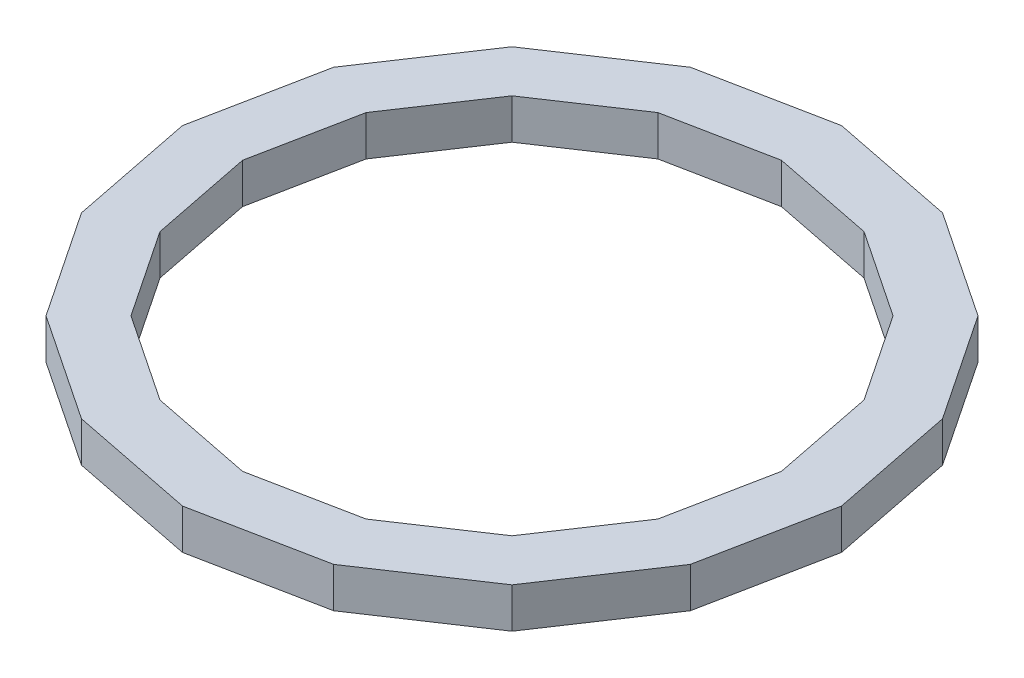
from build123d import *

# Parameters (mm, degrees)
BOSS_EXTRUDE1_DEPTH = 19.05


with BuildPart() as part:
    # Sketch1 → Boss-Extrude1 (new body)
    with BuildSketch(Plane(origin=(0, 0, 0), x_dir=(1, 0, 0), z_dir=(0, 1, 0))):
        Polygon((156.235325694, 0), (144.342619664, 59.788670693), (110.475058259, 110.475058259), (59.788670693, 144.342619664), (0, 156.235325694), (-59.788670693, 144.342619664), (-110.475058259, 110.475058259), (-144.342619664, 59.788670693), (-156.235325694, 0), (-144.342619664, -59.788670693), (-110.475058259, -110.475058259), (-59.788670693, -144.342619664), (0, -156.235325694), (59.788670693, -144.342619664), (110.475058259, -110.475058259), (144.342619664, -59.788670693), align=None)
        Polygon((127.747948734, 0), (118.023715156, 48.887023499), (90.331440832, 90.331440832), (48.887023499, 118.023715156), (0, 127.747948734), (-48.887023499, 118.023715156), (-90.331440832, 90.331440832), (-118.023715156, 48.887023499), (-127.747948734, 0), (-118.023715156, -48.887023499), (-90.331440832, -90.331440832), (-48.887023499, -118.023715156), (0, -127.747948734), (48.887023499, -118.023715156), (90.331440832, -90.331440832), (118.023715156, -48.887023499), align=None, mode=Mode.SUBTRACT)
    extrude(amount=BOSS_EXTRUDE1_DEPTH)


solid = part.part
